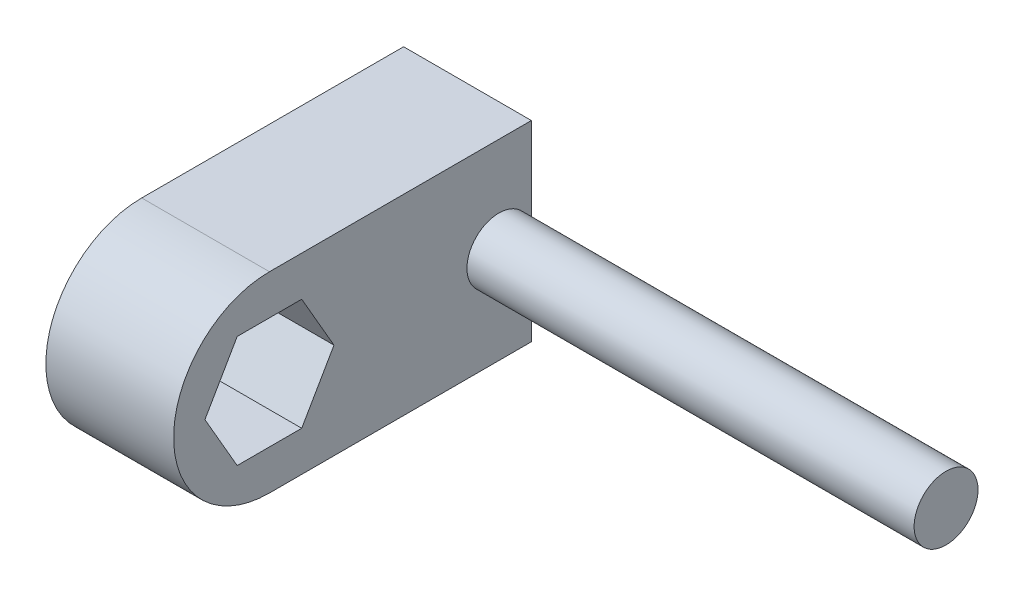
from build123d import *

# Parameters (mm, degrees)
BOSS_EXTRUDE1_DEPTH = 10
SKETCH2_R           = 2.5
BOSS_EXTRUDE2_DEPTH = 35


with BuildPart() as part:
    # Sketch1 → Boss-Extrude1 (new body)
    with BuildSketch(Plane(origin=(0, 0, 0), x_dir=(0, 0, -1), z_dir=(1, 0, 0))):
        with BuildLine():
            Line((0, 7.5), (20.5, 7.5))
            Line((20.5, 7.5), (20.5, -7.5))
            Line((20.5, -7.5), (0, -7.5))
            ThreePointArc((0, -7.5), (-7.5, 0), (0, 7.5))
        make_face()
        Polygon((5.05, 0), (2.525, 4.373428289), (-2.525, 4.373428289), (-5.05, 0), (-2.525, -4.373428289), (2.525, -4.373428289), align=None, mode=Mode.SUBTRACT)
    extrude(amount=BOSS_EXTRUDE1_DEPTH)

    # Sketch2 → Boss-Extrude2 (add)
    with BuildSketch(Plane(origin=(10, 0, 0), x_dir=(0, 0, -1), z_dir=(1, 0, 0))):
        with Locations((17.956042915, 0)):
            Circle(SKETCH2_R)
    extrude(amount=BOSS_EXTRUDE2_DEPTH)


solid = part.part
